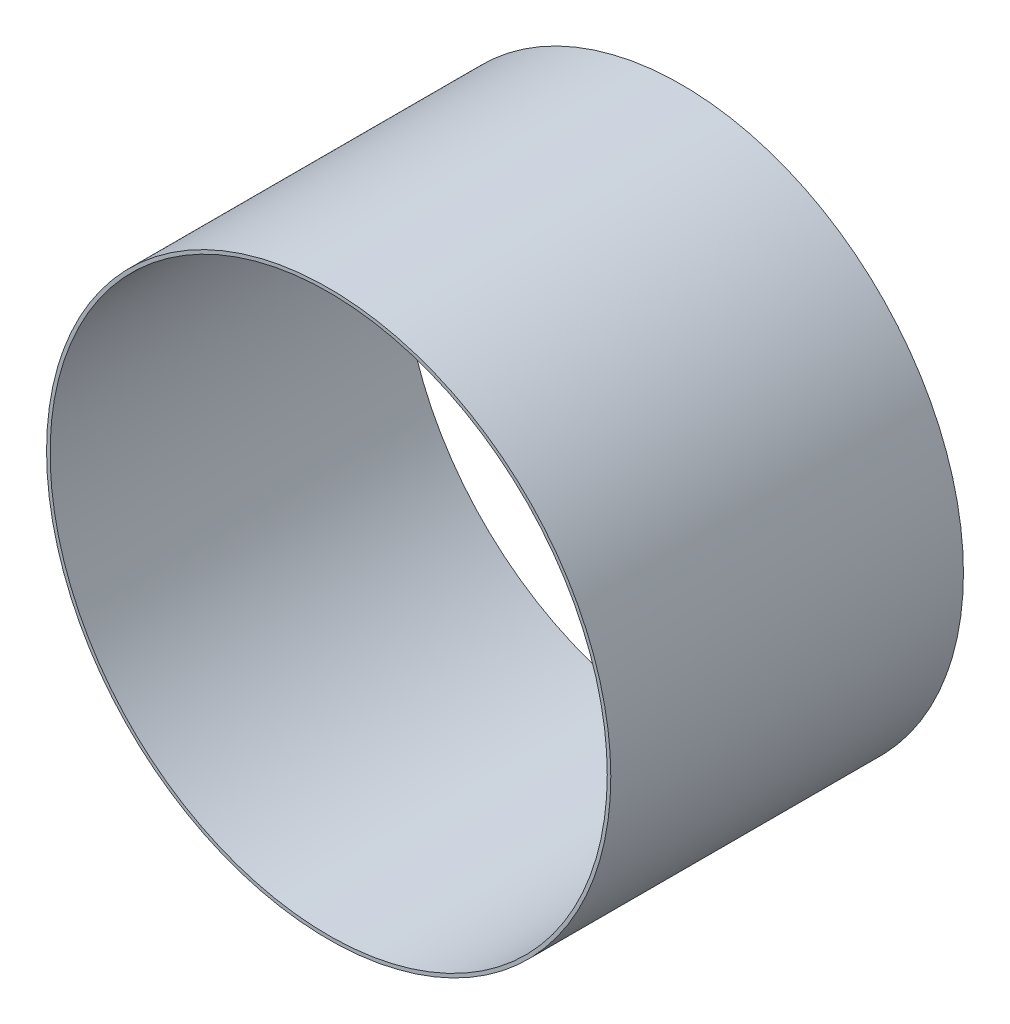
from build123d import *

# Parameters (mm, degrees)
CROQUIS1_R              = 24
CROQUIS1_R_2            = 23.7
SALIENTE_EXTRUIR1_DEPTH = 30


with BuildPart() as part:
    # Croquis1 → Saliente-Extruir1 (new body)
    with BuildSketch(Plane.XY):
        with Locations((-81.704431433, 22.395221445)):
            Circle(CROQUIS1_R)
        with Locations((-81.704431433, 22.395221445)):
            Circle(CROQUIS1_R_2, mode=Mode.SUBTRACT)
    extrude(amount=SALIENTE_EXTRUIR1_DEPTH)


solid = part.part
